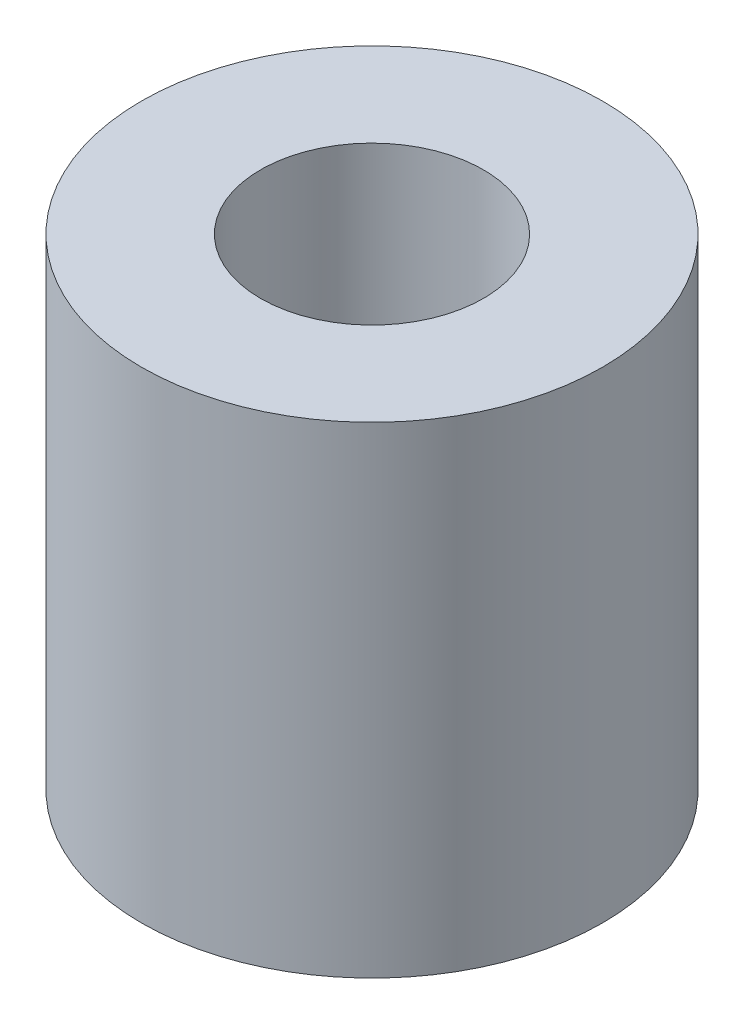
from build123d import *

# Parameters (mm, degrees)
SKETCH_1_R      = 4.55
SKETCH_1_R_2    = 2.2
EXTRUDE_1_DEPTH = 9.5


with BuildPart() as part:
    # 草图1 → 凸台-拉伸1 (new body)
    with BuildSketch(Plane(origin=(0, 0, 0), x_dir=(1, 0, 0), z_dir=(0, 1, 0))):
        with Locations(Location((0, 0, 0), (0, 0, 270))):
            Circle(SKETCH_1_R)
        with Locations(Location((0, 0, 0), (0, 0, 270))):
            Circle(SKETCH_1_R_2, mode=Mode.SUBTRACT)
    extrude(amount=EXTRUDE_1_DEPTH)


solid = part.part
